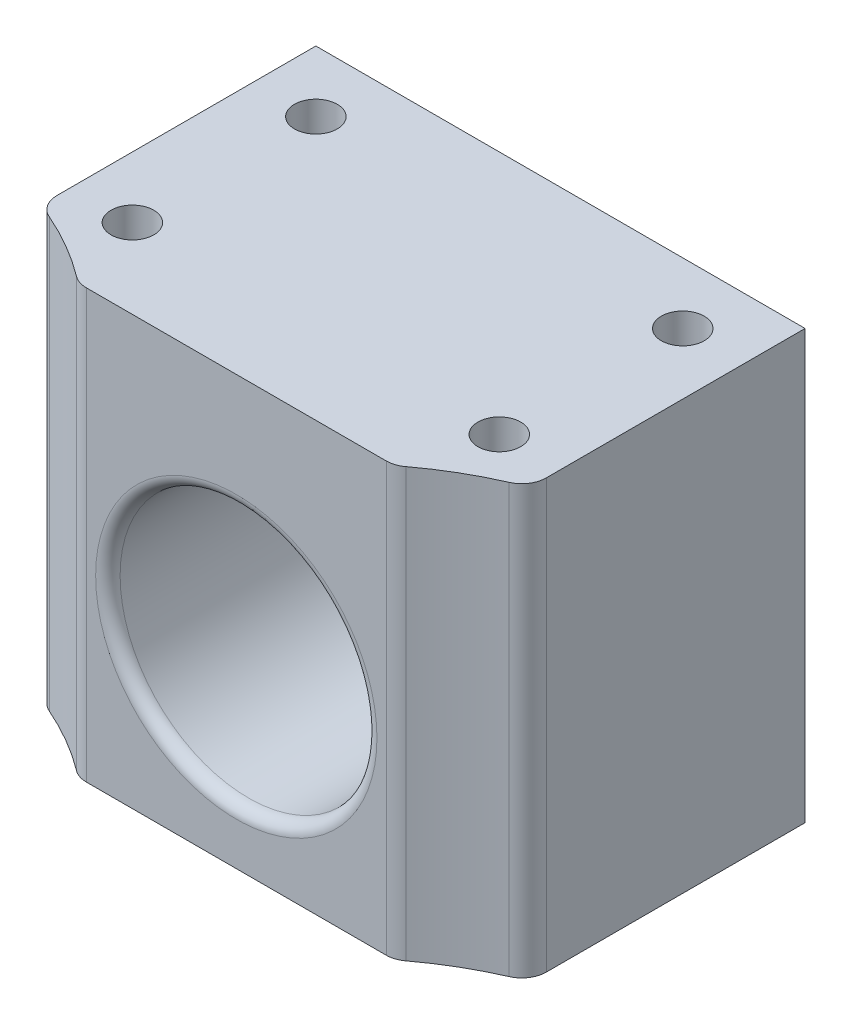
from build123d import *

# Parameters (mm, degrees)
F_35MM_DEPTH          = 35
CUT_EXTRUDE_1_REACH   = 50.244
SKETCH_2_R            = 10.5
FILLET_1_R            = 1
SKETCH_3_R            = 1.75
CUT_EXTRUDE_3_1_DEPTH = 35


with BuildPart() as part:
    # 草图1 → 高35mm (new body)
    with BuildSketch(Plane(origin=(0, 0, 0), x_dir=(1, 0, 0), z_dir=(0, 1, 0))):
        with BuildLine():
            Line((-20, 13.25250025), (-20, -7.909163894))
            ThreePointArc((-20, -7.909163894), (-19.67340752, -9.004475389), (-18.800292729, -9.742066387))
            ThreePointArc((-18.800292729, -9.742066387), (-16.040253129, -11.142625499), (-13.460543724, -12.852737719))
            ThreePointArc((-13.460543724, -12.852737719), (-12.893128183, -13.149929424), (-12.260860414, -13.25250025))
            Line((-12.260860414, -13.25250025), (12.260860414, -13.25250025))
            ThreePointArc((12.260860414, -13.25250025), (12.893128183, -13.149929424), (13.460543724, -12.852737719))
            ThreePointArc((13.460543724, -12.852737719), (16.040253129, -11.142625499), (18.800292729, -9.742066387))
            ThreePointArc((18.800292729, -9.742066387), (19.67340752, -9.004475389), (20, -7.909163894))
            Line((20, -7.909163894), (20, 13.25250025))
            Line((20, 13.25250025), (-20, 13.25250025))
        make_face()
    extrude(amount=F_35MM_DEPTH)

    # 草图2 → 切除-拉伸1 (cut, up to next)
    with BuildSketch(Plane(origin=(0, 0, -13.25250025), x_dir=(-1, 0, 0), z_dir=(0, 0, -1)), mode=Mode.PRIVATE) as cut_extrude_1_sk1:
        with Locations((0, 15)):
            Circle(SKETCH_2_R)
    cut_extrude_1_tool1 = extrude(cut_extrude_1_sk1.sketch, amount=-CUT_EXTRUDE_1_REACH, mode=Mode.PRIVATE) & part.part
    add(cut_extrude_1_tool1.solids().sort_by_distance((0, 15, -13.2525))[0], mode=Mode.SUBTRACT)

    # 圆角1
    fillet_1_edges = [part.edges().sort_by_distance(p)[0] for p in [
        (10.5, 15, -13.25250025),
        (10.5, 15, 13.25250025),
    ]]
    fillet(fillet_1_edges, radius=FILLET_1_R)

    # 草图3 → φ3.1通孔 (cut)
    with BuildSketch(Plane(origin=(0, 35, 0), x_dir=(1, 0, 0), z_dir=(0, 1, 0))):
        with Locations(Location((-15, 8.25250025, 0), (0, 0, 270))):
            Circle(SKETCH_3_R)
        with Locations(Location((-15, -6.74749975, 0), (0, 0, 270))):
            Circle(SKETCH_3_R)
        with Locations(Location((15, -6.74749975, 0), (0, 0, 90))):
            Circle(SKETCH_3_R)
        with Locations(Location((15, 8.25250025, 0), (0, 0, 90))):
            Circle(SKETCH_3_R)
    extrude(amount=-CUT_EXTRUDE_3_1_DEPTH, mode=Mode.SUBTRACT)


solid = part.part
